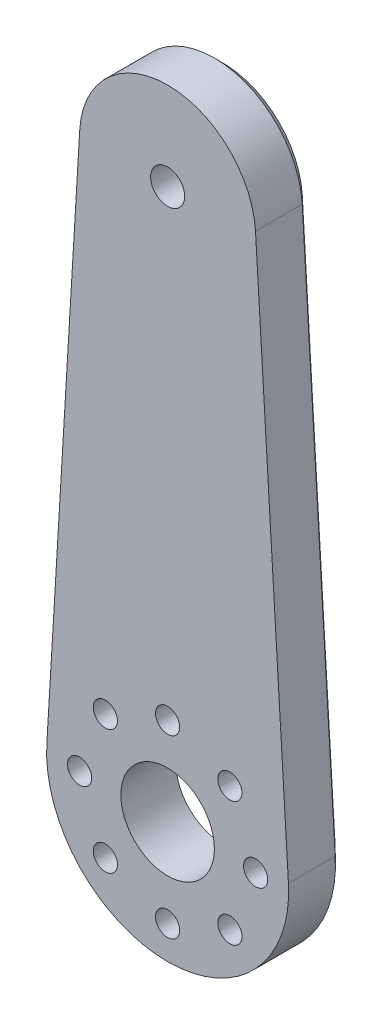
from build123d import *

# Parameters (mm, degrees)
SKETCH1_R           = 1.55
SKETCH1_R_2         = 4.25
SKETCH1_R_3         = 1.1
BOSS_EXTRUDE1_DEPTH = 5
CUT_EXTRUDE2_DEPTH  = 2
SKETCH4_R           = 1.75
CUT_EXTRUDE3_DEPTH  = 2.25
CHAFL_N1_SIZE       = 0.75


with BuildPart() as part:
    # Sketch1 → Boss-Extrude1 (new body)
    with BuildSketch(Plane.XY):
        with BuildLine():
            Line((-23.123880441, 31.396096398), (-26.118475572, -18.423903602))
            ThreePointArc((-26.118475572, -18.423903602), (-15.138293424, -30.083903602), (-4.158111277, -18.423903602))
            Line((-4.158111277, -18.423903602), (-7.152706408, 31.396096398))
            ThreePointArc((-7.152706408, 31.396096398), (-15.138293424, 38.916096398), (-23.123880441, 31.396096398))
        make_face()
        with Locations((-15.138293424, 30.916096398)):
            Circle(SKETCH1_R, mode=Mode.SUBTRACT)
        with Locations((-15.138293424, -19.083903602)):
            Circle(SKETCH1_R_2, mode=Mode.SUBTRACT)
        with Locations((-7.138293424, -19.083903602)):
            Circle(SKETCH1_R_3, mode=Mode.SUBTRACT)
        with Locations((-9.481439175, -24.740757851)):
            Circle(SKETCH1_R_3, mode=Mode.SUBTRACT)
        with Locations((-15.138293424, -27.083903602)):
            Circle(SKETCH1_R_3, mode=Mode.SUBTRACT)
        with Locations((-20.795147674, -24.740757851)):
            Circle(SKETCH1_R_3, mode=Mode.SUBTRACT)
        with Locations((-23.138293424, -19.083903602)):
            Circle(SKETCH1_R_3, mode=Mode.SUBTRACT)
        with Locations((-20.795147674, -13.427049352)):
            Circle(SKETCH1_R_3, mode=Mode.SUBTRACT)
        with Locations((-15.138293424, -11.083903602)):
            Circle(SKETCH1_R_3, mode=Mode.SUBTRACT)
        with Locations((-9.481439175, -13.427049352)):
            Circle(SKETCH1_R_3, mode=Mode.SUBTRACT)
    extrude(amount=BOSS_EXTRUDE1_DEPTH)

    # Sketch3 → Cut-Extrude2 (cut)
    with BuildSketch(Plane.XY):
        Polygon((-13.550580184, 28.166096398), (-11.962866944, 30.916096398), (-13.550580184, 33.666096398), (-16.726006665, 33.666096398), (-18.313719905, 30.916096398), (-16.726006665, 28.166096398), align=None)
    extrude(amount=CUT_EXTRUDE2_DEPTH, mode=Mode.SUBTRACT)

    # Sketch4 → Cut-Extrude3 (cut)
    with BuildSketch(Plane(origin=(0, 0, 0), x_dir=(-1, 0, 0), z_dir=(0, 0, -1))):
        with Locations((23.138293424, -19.083903602)):
            Circle(SKETCH4_R)
        with Locations((20.795147674, -24.740757851)):
            Circle(SKETCH4_R)
        with Locations((15.138293424, -27.083903602)):
            Circle(SKETCH4_R)
        with Locations((9.481439175, -24.740757851)):
            Circle(SKETCH4_R)
        with Locations((7.138293424, -19.083903602)):
            Circle(SKETCH4_R)
        with Locations((9.481439175, -13.427049352)):
            Circle(SKETCH4_R)
        with Locations((15.138293424, -11.083903602)):
            Circle(SKETCH4_R)
        with Locations((20.795147674, -13.427049352)):
            Circle(SKETCH4_R)
    extrude(amount=-CUT_EXTRUDE3_DEPTH, mode=Mode.SUBTRACT)

    # Chaflán1
    chafl_n1_edges = [part.edges().sort_by_distance(p)[0] for p in [
        (-5.655408842, 6.486096398, 0),
        (-15.138293424, -30.083903602, 0),
        (-24.621178007, 6.486096398, 0),
        (-15.138293424, 38.916096398, 0),
    ]]
    chamfer(chafl_n1_edges, length=CHAFL_N1_SIZE)


solid = part.part
